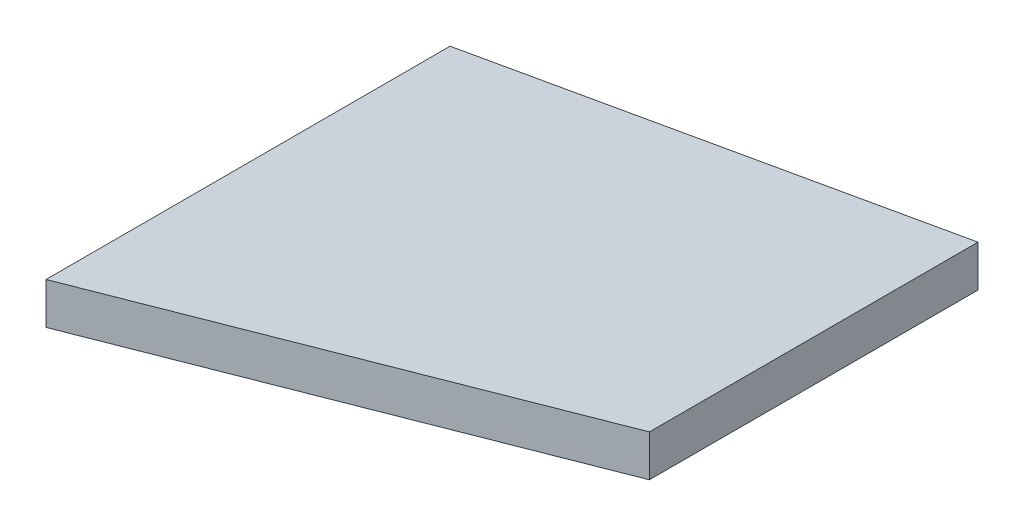
from build123d import *

# Parameters (mm, degrees)
BOSS_EXTRUDE1_DEPTH = 100
CUT_EXTRUDE1_DEPTH  = 65


with BuildPart() as part:
    # Sketch2 → Boss-Extrude1 (new body)
    with BuildSketch(Plane.XY):
        Polygon((140, 42.9352812), (140, 32.666666667), (0, 0), (0, 10.268614534), align=None)
    extrude(amount=BOSS_EXTRUDE1_DEPTH)

    # Sketch4 → Cut-Extrude1 (cut)
    with BuildSketch(Plane(origin=(0, 0, 0), x_dir=(1, 0, 0), z_dir=(0, 1, 0))):
        Polygon((0, 0), (140, 0), (140, -9.333333333), align=None)
        Polygon((140, -90.666666667), (0, -100), (140, -100), align=None)
    extrude(amount=CUT_EXTRUDE1_DEPTH, mode=Mode.SUBTRACT)


solid = part.part
